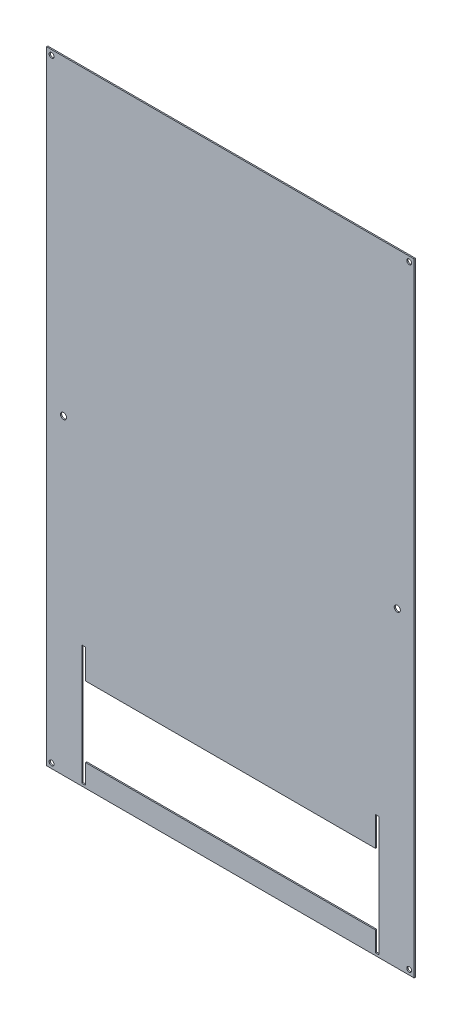
from build123d import *

# Parameters (mm, degrees)
SKETCH2_W           = 478
SKETCH2_H           = 809.900101531
SKETCH2_R           = 3.175
SKETCH2_R_2         = 3.96875
BOSS_EXTRUDE1_DEPTH = 1.6002


with BuildPart() as part:
    # Sketch2 → Boss-Extrude1 (new body)
    with BuildSketch(Plane.XY):
        with Locations((-130.152406859, 514.031343345)):
            Rectangle(SKETCH2_W, SKETCH2_H)
        with Locations((-362.710206859, 115.522426029)):
            Circle(SKETCH2_R, mode=Mode.SUBTRACT)
        with Locations((102.405393141, 912.54036211)):
            Circle(SKETCH2_R, mode=Mode.SUBTRACT)
        with Locations((-362.710206859, 912.54036211)):
            Circle(SKETCH2_R, mode=Mode.SUBTRACT)
        with Locations((102.405393141, 115.522426029)):
            Circle(SKETCH2_R, mode=Mode.SUBTRACT)
        with Locations((86.893613141, 514.031343345)):
            Circle(SKETCH2_R_2, mode=Mode.SUBTRACT)
        with Locations((-347.198426859, 514.031343345)):
            Circle(SKETCH2_R_2, mode=Mode.SUBTRACT)
        Polygon((63.111393141, 112.35889233), (63.111393141, 229.898149855), (63.111393141, 268.081394028), (58.348893141, 268.081394028), (58.348893141, 229.898149855), (-318.667460794, 229.898149855), (-318.667460794, 268.081394028), (-323.429960794, 268.081394028), (-323.429960794, 229.898149855), (-323.429960794, 112.35889233), (-318.667460794, 112.35889233), (-318.667460794, 138.081394028), (58.348893141, 138.081394028), (58.348893141, 112.35889233), align=None, mode=Mode.SUBTRACT)
    extrude(amount=BOSS_EXTRUDE1_DEPTH)


solid = part.part
